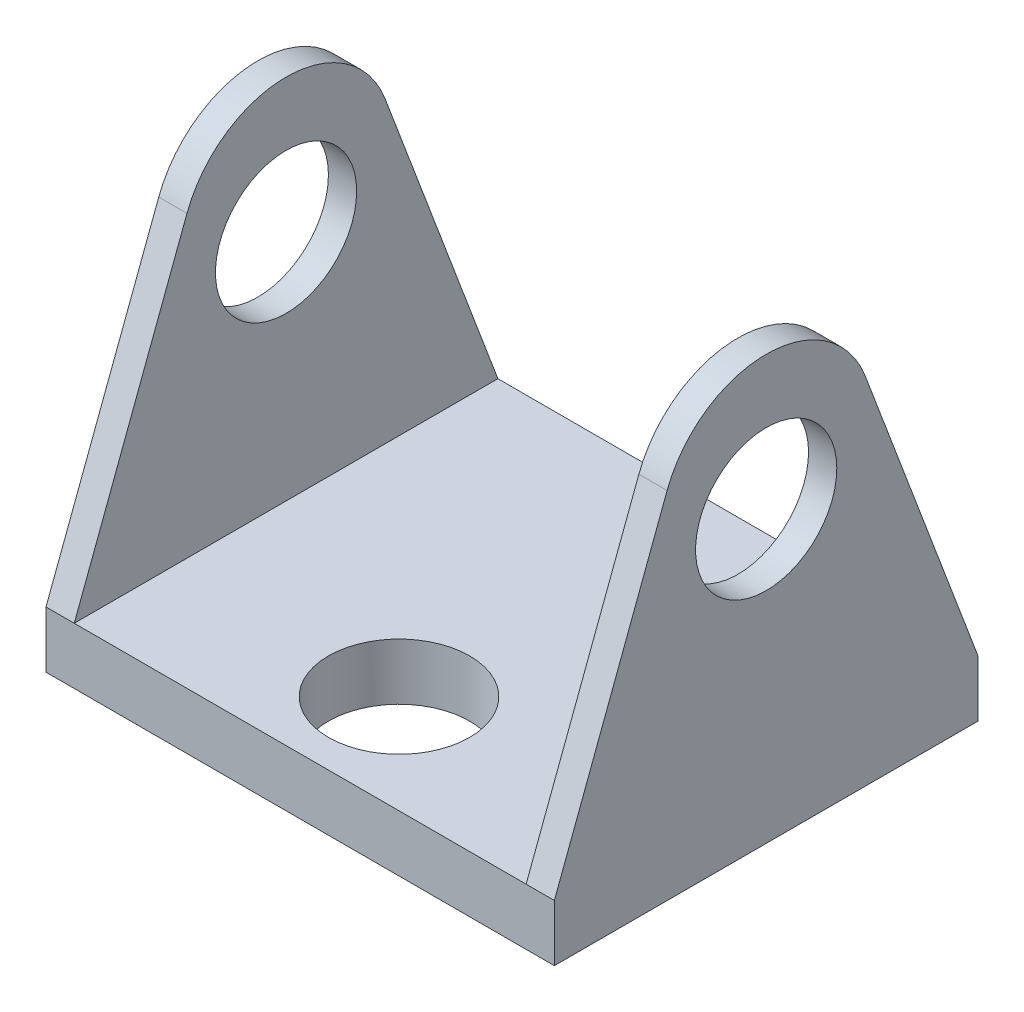
from build123d import *

# Parameters (mm, degrees)
SKETCH1_W               = 32
SKETCH1_H               = 4
BOSS_EXTRUDE1_DEPTH     = 30
CUT_EXTRUDE1_DEPTH      = 45.810713005
CUT_EXTRUDE1_DEPTH_BACK = 45.810713005
SKETCH2_R               = 5
CUT_EXTRUDE2_DEPTH      = 45.810713005
CUT_EXTRUDE2_DEPTH_BACK = 45.810713005
SKETCH3_R               = 5


with BuildPart() as part:
    # Sketch1 → Boss-Extrude1 (new body)
    with BuildSketch(Plane.XY):
        Polygon((-18, -2), (-16, -2), (-16, 2), (-16, 28), (-18, 28), align=None)
        Rectangle(SKETCH1_W, SKETCH1_H)
        Polygon((16, 2), (16, -2), (18, -2), (18, 28), (16, 28), align=None)
    extrude(amount=-BOSS_EXTRUDE1_DEPTH)

    # Sketch2 → Cut-Extrude1 (cut, two sides: drawn at the far end of the back side and taken through both)
    with BuildSketch(Plane(origin=(0, 0, 0), x_dir=(0, 0, -1), z_dir=(1, 0, 0)).offset(-CUT_EXTRUDE1_DEPTH_BACK)):
        with BuildLine():
            ThreePointArc((22.016723912, 23.148695064), (15, 28), (7.983276088, 23.148695064))
            Line((7.983276088, 23.148695064), (0, 2))
            Line((0, 2), (-5, 2))
            Line((-5, 2), (-5, 38))
            Line((-5, 38), (35, 38))
            Line((35, 38), (35, 2))
            Line((35, 2), (30, 2))
            Line((30, 2), (22.016723912, 23.148695064))
        make_face()
        with Locations((15, 18.5)):
            Circle(SKETCH2_R)
    extrude(amount=CUT_EXTRUDE1_DEPTH + CUT_EXTRUDE1_DEPTH_BACK, mode=Mode.SUBTRACT)

    # Sketch3 → Cut-Extrude2 (cut, two sides: drawn at the far end of the back side and taken through both)
    with BuildSketch(Plane(origin=(0, 0, 0), x_dir=(1, 0, 0), z_dir=(0, 1, 0)).offset(-CUT_EXTRUDE2_DEPTH_BACK)):
        with Locations(Location((0, 7, 0), (0, 0, 270))):
            Circle(SKETCH3_R)
    extrude(amount=CUT_EXTRUDE2_DEPTH + CUT_EXTRUDE2_DEPTH_BACK, mode=Mode.SUBTRACT)


solid = part.part
